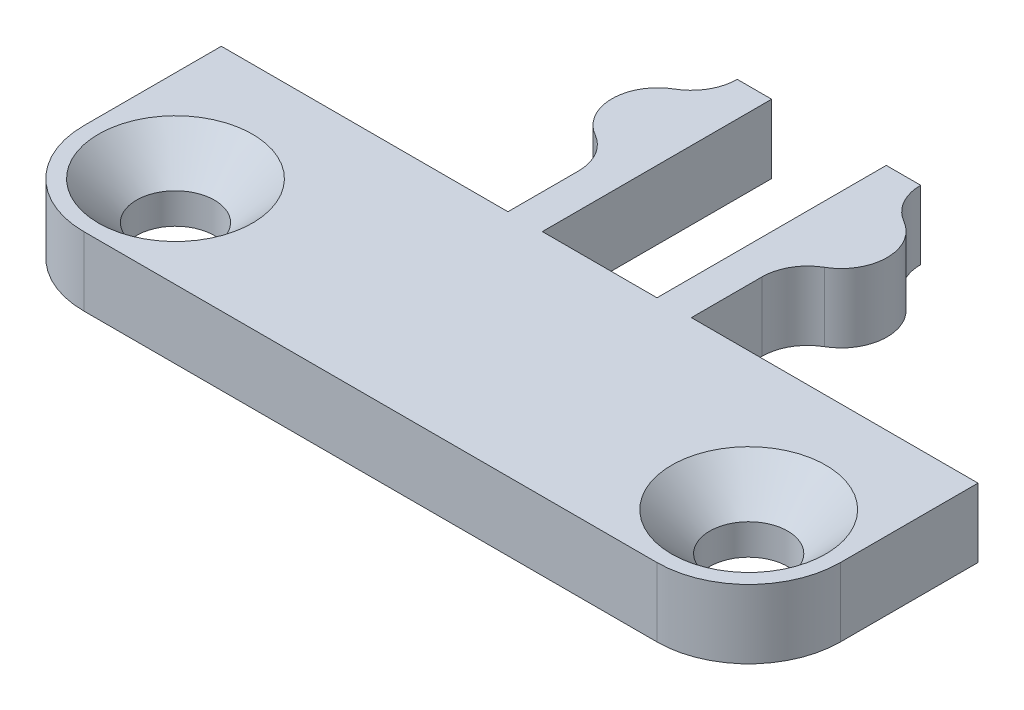
from build123d import *

# Parameters (mm, degrees)
SKETCH1_W                     = 33
SKETCH1_H                     = 10
BOSS_EXTRUDE1_DEPTH           = 3
CSK_FOR_M3_SFHCS1_D           = 3.4
CSK_FOR_M3_SFHCS1_DEPTH       = 10
CSK_FOR_M3_SFHCS1_CSINK_D     = 6.72
CSK_FOR_M3_SFHCS1_CSINK_ANGLE = 90
CSK_FOR_M3_SFHCS1_TIP         = 1.021463052
FILLET1_R                     = 4


with BuildPart() as part:
    # Sketch1 → Boss-Extrude1 (new body)
    with BuildSketch(Plane(origin=(0, 0, 0), x_dir=(1, 0, 0), z_dir=(0, 1, 0))):
        with Locations((0, -5)):
            Rectangle(SKETCH1_W, SKETCH1_H)
        with BuildLine():
            Line((-4, 0), (-2.5, 0))
            Line((-2.5, 0), (-2.5, 10))
            Line((-2.5, 10), (-4, 10))
            ThreePointArc((-4, 10), (-4.267949192, 9), (-5, 8.267949192))
            ThreePointArc((-5, 8.267949192), (-6, 6.535898385), (-5, 4.803847577))
            ThreePointArc((-5, 4.803847577), (-4.267949192, 4.07179677), (-4, 3.07179677))
            Line((-4, 3.07179677), (-4, 0))
        make_face()
        with BuildLine():
            Line((2.5, 10), (2.5, 0))
            Line((2.5, 0), (4, 0))
            Line((4, 0), (4, 3.07179677))
            ThreePointArc((4, 3.07179677), (4.267949192, 4.07179677), (5, 4.803847577))
            ThreePointArc((5, 4.803847577), (6, 6.535898385), (5, 8.267949192))
            ThreePointArc((5, 8.267949192), (4.267949192, 9), (4, 10))
            Line((4, 10), (2.5, 10))
        make_face()
    extrude(amount=BOSS_EXTRUDE1_DEPTH)

    # CSK for M3 SFHCS1
    with Locations(Plane(origin=(0, 3, 0), x_dir=(1, 0, 0), z_dir=(0, 1, 0))):
        with Locations((-12.5, -6), (12.5, -6)):
            CounterSinkHole(CSK_FOR_M3_SFHCS1_D / 2, CSK_FOR_M3_SFHCS1_CSINK_D / 2, depth=CSK_FOR_M3_SFHCS1_DEPTH, counter_sink_angle=CSK_FOR_M3_SFHCS1_CSINK_ANGLE)
            with Locations((0, 0, -(CSK_FOR_M3_SFHCS1_DEPTH + CSK_FOR_M3_SFHCS1_TIP / 2))):  # 118° drill point
                Cone(0, CSK_FOR_M3_SFHCS1_D / 2, CSK_FOR_M3_SFHCS1_TIP, mode=Mode.SUBTRACT)

    # Fillet1
    fillet1_edges = [part.edges().sort_by_distance(p)[0] for p in [
        (16.5, 1.5, 10),
        (-16.5, 1.5, 10),
    ]]
    fillet(fillet1_edges, radius=FILLET1_R)


solid = part.part
